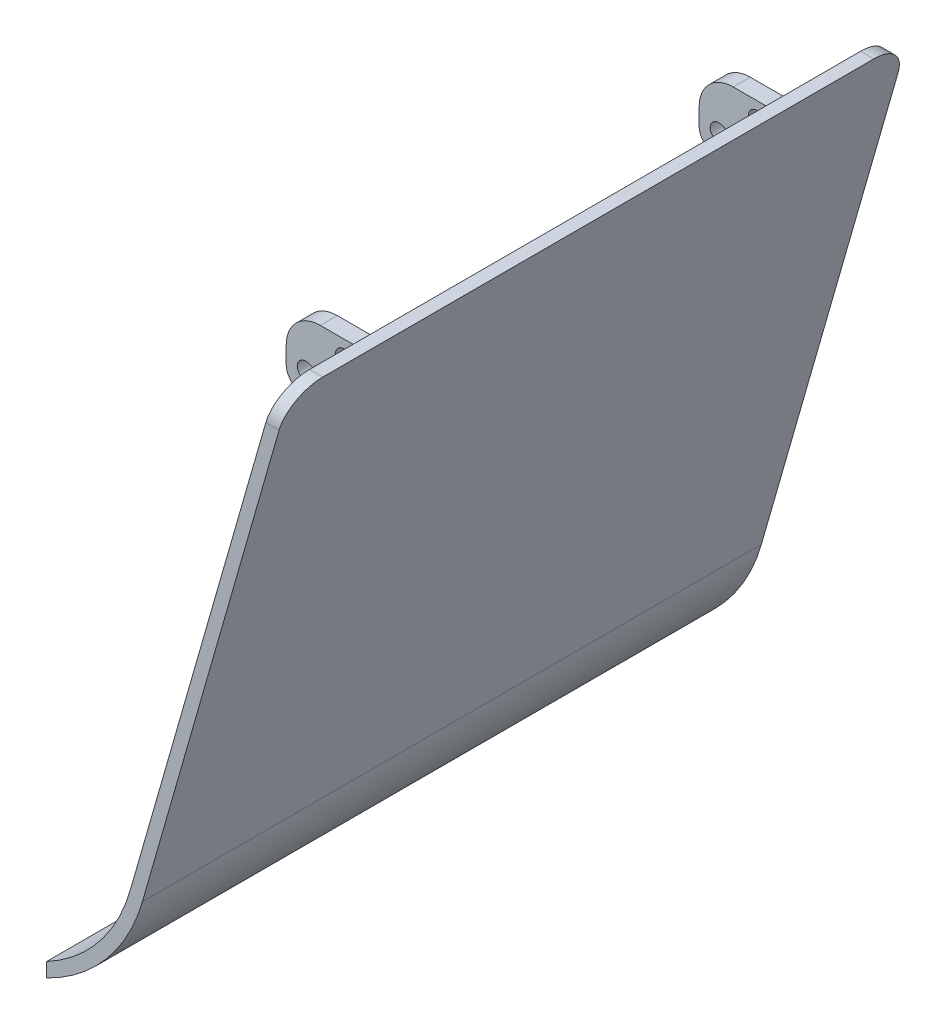
from build123d import *

# Parameters (mm, degrees)
BOSS_EXTRUDE1_DEPTH   = 36.425
CUT_EXTRUDE1_DEPTH    = 110.090212662
CUT_EXTRUDE2_DEPTH    = 109.098783751
FILLET1_R             = 4
BOSS_EXTRUDE14_START  = 25.3
BOSS_EXTRUDE14_DEPTH  = 2
CUT_EXTRUDE10_DEPTH   = 5
FILLET13_R            = 4
FILLET14_R            = 2
FILLET13_OF_MIRROR1_R = 4
FILLET14_OF_MIRROR1_R = 2


with BuildPart() as part:
    # Sketch1 → Boss-Extrude1 (new, symmetric)
    with BuildSketch(Plane.XY):
        with BuildLine():
            Line((0, 0), (-17.110884891, -59.672747116))
            ThreePointArc((-17.110884891, -59.672747116), (-22.347799076, -68.454296451), (-31.240591359, -73.5))
            Line((-31.240591359, -73.5), (-30.858426801, -74.9505))
            ThreePointArc((-30.858426801, -74.9505), (-21.298675096, -69.526368685), (-15.668992347, -60.08620315))
            Line((-15.668992347, -60.08620315), (1.441892544, -0.413456034))
            Line((1.441892544, -0.413456034), (1.560449154, 0))
            Line((1.560449154, 0), (0, 0))
        make_face()
    extrude(amount=BOSS_EXTRUDE1_DEPTH, both=True)

    # Sketch2 → Cut-Extrude1 (cut, through all)
    with BuildSketch(Plane.XY.offset(36.425)):
        with BuildLine():
            Line((-31.240591359, -73.5), (-26.943866684, -73.5))
            ThreePointArc((-26.943866684, -73.5), (-28.865857957, -74.320486174), (-30.858426801, -74.9505))
            Line((-30.858426801, -74.9505), (-31.240591359, -73.5))
        make_face()
    extrude(amount=-CUT_EXTRUDE1_DEPTH, mode=Mode.SUBTRACT)

    # Sketch3 → Cut-Extrude2 (cut, through all)
    with BuildSketch(Plane.XY.offset(36.425)):
        with BuildLine():
            Line((-26.943866684, -73.5), (-31.240591359, -73.5))
            ThreePointArc((-31.240591359, -73.5), (-29.043541661, -72.783058785), (-26.943866684, -71.817451685))
            Line((-26.943866684, -71.817451685), (-26.943866684, -73.5))
        make_face()
    extrude(amount=-CUT_EXTRUDE2_DEPTH, mode=Mode.SUBTRACT)

    # Fillet1
    fillet1_edges = [part.edges().sort_by_distance(p)[0] for p in [
        (0.780224577, 0, 36.425),
        (0.780224577, 0, -36.425),
    ]]
    fillet(fillet1_edges, radius=FILLET1_R)

    # Sketch33 → Boss-Extrude14 (add)
    with BuildSketch(Plane.XY.offset(BOSS_EXTRUDE14_START)):
        Polygon((-0.573490772, -2), (-9.867453858, -2), (-9.867453858, -10), (-2.867453858, -10), align=None)
    boss_extrude14 = extrude(amount=-BOSS_EXTRUDE14_DEPTH)

    # Sketch34 → Cut-Extrude10 (cut)
    with BuildSketch(Plane.XY.offset(25.3)):
        with BuildLine():
            ThreePointArc((-2.090857418, -3.811861892), (-3.261138108, -3.017857418), (-4.055142582, -4.188138108))
            ThreePointArc((-4.055142582, -4.188138108), (-4.865186914, -6.338616825), (-7.148892582, -6.594388108))
            ThreePointArc((-7.148892582, -6.594388108), (-8.478611892, -7.075892582), (-7.997107418, -8.405611892))
            ThreePointArc((-7.997107418, -8.405611892), (-3.637305687, -7.91732126), (-2.090857418, -3.811861892))
        make_face()
    cut_extrude10 = extrude(amount=-CUT_EXTRUDE10_DEPTH, mode=Mode.SUBTRACT)

    # Fillet13
    fillet13_edges = [part.edges().sort_by_distance(p)[0] for p in [
        (-9.867453858, -2, 24.3),
    ]]
    fillet(fillet13_edges, radius=FILLET13_R)

    # Fillet14
    fillet14_edges = [part.edges().sort_by_distance(p)[0] for p in [
        (-9.867453858, -10, 24.3),
    ]]
    fillet(fillet14_edges, radius=FILLET14_R)

    # Mirror1: Boss-Extrude14, Cut-Extrude10 across plane
    add(boss_extrude14.mirror(Plane.XY))
    add(cut_extrude10.mirror(Plane.XY), mode=Mode.SUBTRACT)

    # Fillet13 of Mirror1
    fillet13_of_mirror1_edges = [part.edges().sort_by_distance(p)[0] for p in [
        (-9.867453858, -2, -24.3),
    ]]
    fillet(fillet13_of_mirror1_edges, radius=FILLET13_OF_MIRROR1_R)

    # Fillet14 of Mirror1
    fillet14_of_mirror1_edges = [part.edges().sort_by_distance(p)[0] for p in [
        (-9.867453858, -10, -24.3),
    ]]
    fillet(fillet14_of_mirror1_edges, radius=FILLET14_OF_MIRROR1_R)


solid = part.part
